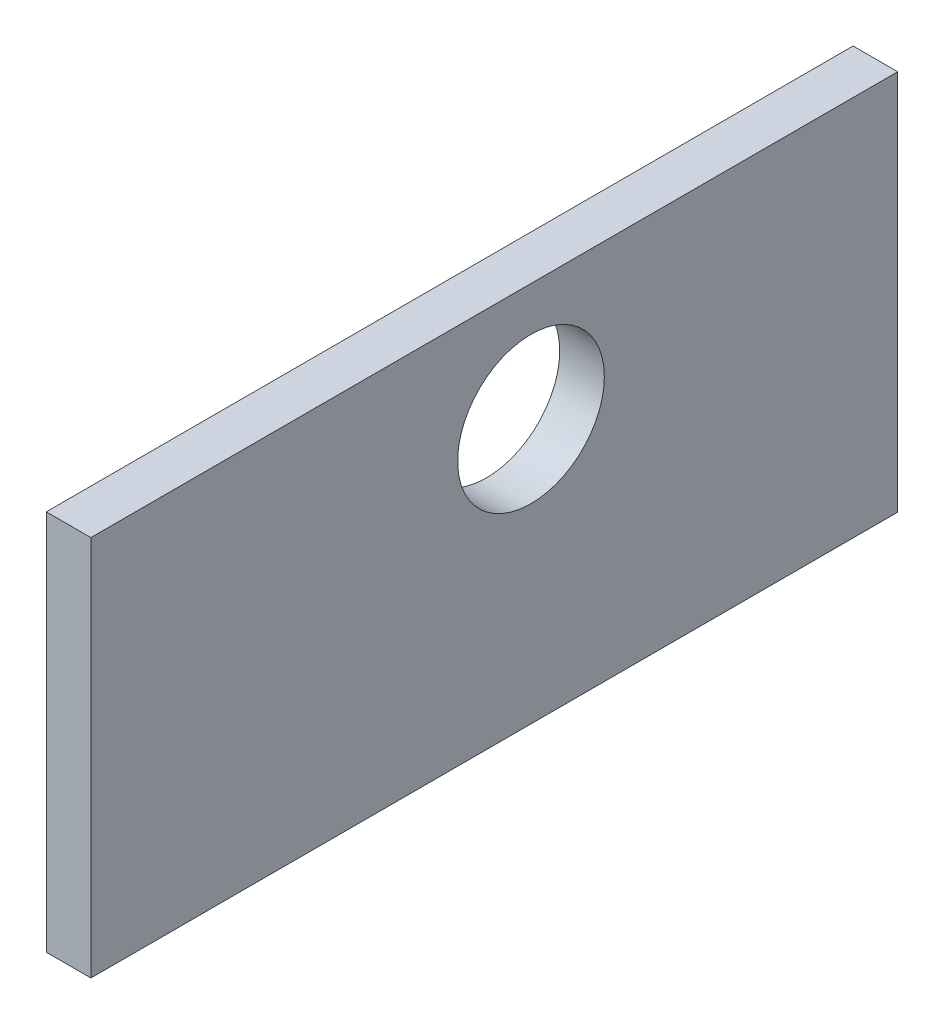
from build123d import *

# Parameters (mm, degrees)
SKETCH1_W           = 87.3125
SKETCH1_H           = 41.275
SKETCH1_R           = 7.9375
BOSS_EXTRUDE1_DEPTH = 4.826


with BuildPart() as part:
    # Sketch1 → Boss-Extrude1 (new body)
    with BuildSketch(Plane(origin=(0, 0, 0), x_dir=(0, 0, -1), z_dir=(1, 0, 0))):
        with Locations((-3.96875, -7.9375)):
            Rectangle(SKETCH1_W, SKETCH1_H)
        Circle(SKETCH1_R, mode=Mode.SUBTRACT)
    extrude(amount=BOSS_EXTRUDE1_DEPTH)


solid = part.part
